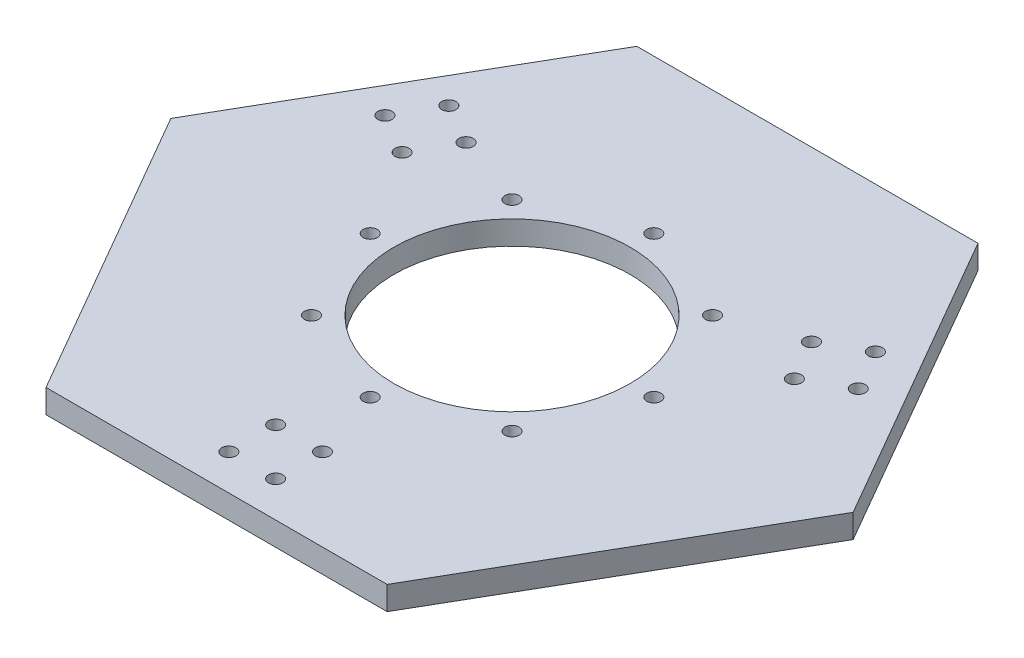
from build123d import *

# Parameters (mm, degrees)
EXTRUDE_1_DEPTH          = 5
SKETCH_2_R               = 25
CUT_EXTRUDE_1_DEPTH      = 5
SKETCH_3_R               = 1.5
CUT_EXTRUDE_2_DEPTH      = 5
PATTERN_CIRCULAR_1_COUNT = 3
SKETCH_5_R               = 1.5
CUT_EXTRUDE_3_DEPTH      = 13
PATTERN_CIRCULAR_2_COUNT = 8


with BuildPart() as part:
    # 草图1 → 凸台-拉伸1 (new body)
    with BuildSketch(Plane(origin=(0, 0, 0), x_dir=(1, 0, 0), z_dir=(0, 1, 0))):
        Polygon((36.084391824, 62.5), (-36.084391824, 62.5), (-72.168783649, 0), (-36.084391824, -62.5), (36.084391824, -62.5), (72.168783649, 0), align=None)
    extrude(amount=EXTRUDE_1_DEPTH)

    # 草图2 → 切除-拉伸1 (cut)
    with BuildSketch(Plane(origin=(0, 5, 0), x_dir=(1, 0, 0), z_dir=(0, 1, 0))):
        with Locations(Location((0, 0, 0), (0, 0, 270))):
            Circle(SKETCH_2_R)
    extrude(amount=-CUT_EXTRUDE_1_DEPTH, mode=Mode.SUBTRACT)

    # 草图3 → 切除-拉伸2 (cut)
    with BuildSketch(Plane(origin=(0, 5, 0), x_dir=(1, 0, 0), z_dir=(0, 1, 0))):
        with Locations(Location((-4.95, -45.05, 0), (0, 0, 270))):
            Circle(SKETCH_3_R)
        with Locations(Location((4.95, -45.05, 0), (0, 0, 270))):
            Circle(SKETCH_3_R)
        with Locations(Location((-4.95, -54.95, 0), (0, 0, 270))):
            Circle(SKETCH_3_R)
        with Locations(Location((4.95, -54.95, 0), (0, 0, 270))):
            Circle(SKETCH_3_R)
    cut_extrude_2 = extrude(amount=-CUT_EXTRUDE_2_DEPTH, mode=Mode.SUBTRACT)

    # 阵列(圆周)1: 切除-拉伸2 ×3 about axis
    pattern_circular_1_axis = Axis((0, 0, 0), (0, 1, 0))
    for i in range(1, PATTERN_CIRCULAR_1_COUNT):
        add(cut_extrude_2.rotate(pattern_circular_1_axis, i * 360 / PATTERN_CIRCULAR_1_COUNT), mode=Mode.SUBTRACT)

    # 草图5 → 切除-拉伸3 (cut)
    with BuildSketch(Plane.XZ):
        with Locations(Location((0, 30, 0), (0, 0, 270))):
            Circle(SKETCH_5_R)
    cut_extrude_3 = extrude(amount=-CUT_EXTRUDE_3_DEPTH, mode=Mode.SUBTRACT)

    # 阵列(圆周)2: 切除-拉伸3 ×8 about axis
    pattern_circular_2_axis = Axis((0, 0, 0), (0, 1, 0))
    for i in range(1, PATTERN_CIRCULAR_2_COUNT):
        add(cut_extrude_3.rotate(pattern_circular_2_axis, i * 360 / PATTERN_CIRCULAR_2_COUNT), mode=Mode.SUBTRACT)


solid = part.part
